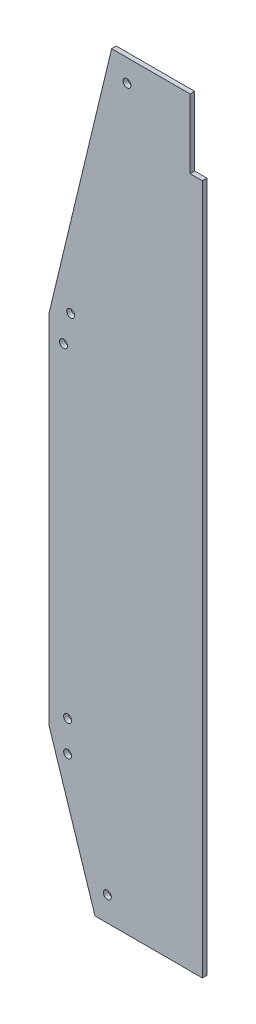
from build123d import *

# Parameters (mm, degrees)
BOSS_EXTRU_1_DEPTH      = 3
ESQUISSE2_R             = 2.6
ENL_V_MAT_EXTRU_1_DEPTH = 20


with BuildPart() as part:
    # Esquisse1 → Boss.-Extru.1 (new body)
    with BuildSketch(Plane.XY):
        Polygon((0, 450.3), (-8, 450.3), (-8, 495.3), (-59.18, 495.3), (-100, 325.5), (-100, 92.65), (-70, 0), (0, 0), align=None)
    extrude(amount=BOSS_EXTRU_1_DEPTH)

    # Esquisse2 → Enlèv. mat.-Extru.1 (cut)
    with BuildSketch(Plane(origin=(0, 0, 0), x_dir=(-1, 0, 0), z_dir=(0, 0, -1))):
        with Locations((61.969716149, 16)):
            Circle(ESQUISSE2_R)
        with Locations((87.865603026, 82.65)):
            Circle(ESQUISSE2_R)
        with Locations((87.865603026, 102.65)):
            Circle(ESQUISSE2_R)
        with Locations((85.860605504, 332.418095432)):
            Circle(ESQUISSE2_R)
        with Locations((90.535427638, 312.972118007)):
            Circle(ESQUISSE2_R)
        with Locations((49.168739911, 480.767951321)):
            Circle(ESQUISSE2_R)
    extrude(amount=-ENL_V_MAT_EXTRU_1_DEPTH, mode=Mode.SUBTRACT)


solid = part.part
